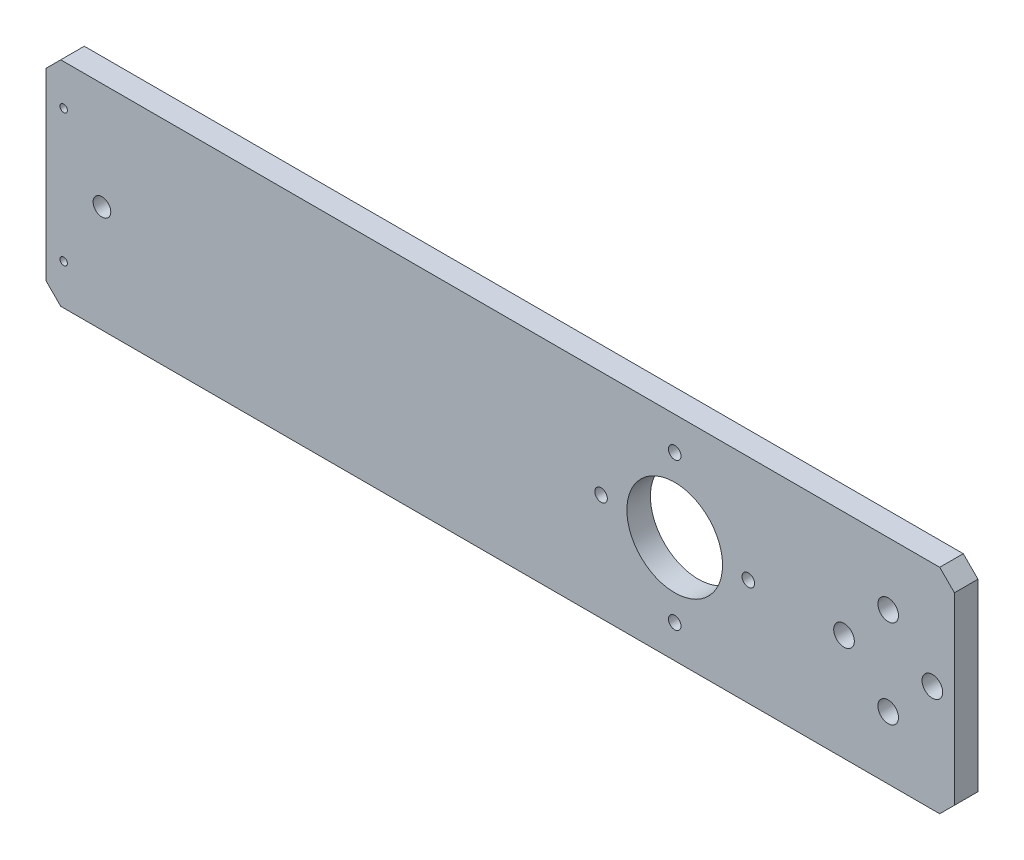
from build123d import *

# Parameters (mm, degrees)
SKETCH_1_R              = 7
SKETCH_1_R_2            = 3
SKETCH_1_R_3            = 32.5
EXTRUDE_1_DEPTH         = 16
HOLE_WIZARD_M14_1_D     = 12
HOLE_WIZARD_M14_1_DEPTH = 34
HOLE_WIZARD_M14_1_TIP   = 3.605163714
HOLE_WIZARD_M6_1_D      = 5
HOLE_WIZARD_M6_1_DEPTH  = 18
HOLE_WIZARD_M6_1_TIP    = 1.502151548
HOLE_WIZARD_M10_2_D     = 8.5
HOLE_WIZARD_M10_2_DEPTH = 24.5
HOLE_WIZARD_M10_2_TIP   = 2.553657631


with BuildPart() as part:
    # 草图1 → 凸台-拉伸1 (new body)
    with BuildSketch(Plane.XY):
        Polygon((637.687566056, 879.677968159), (637.687566056, 754.677968159), (647.687566056, 744.677968159), (1244.687566056, 744.677968159), (1254.687566056, 754.677968159), (1254.687566056, 879.677968159), (1244.687566056, 889.677968159), (647.687566056, 889.677968159), align=None)
        with Locations((1209.687566056, 787.177968159)):
            Circle(SKETCH_1_R, mode=Mode.SUBTRACT)
        with Locations((1064.687566056, 767.177968159)):
            Circle(SKETCH_1_R_2, mode=Mode.SUBTRACT)
        with Locations((1064.687566056, 817.177968159)):
            Circle(SKETCH_1_R_3, mode=Mode.SUBTRACT)
        with Locations((1014.687566056, 817.177968159)):
            Circle(SKETCH_1_R_2, mode=Mode.SUBTRACT)
        with Locations((1114.687566056, 817.177968159)):
            Circle(SKETCH_1_R_2, mode=Mode.SUBTRACT)
        with Locations((1064.687566056, 867.177968159)):
            Circle(SKETCH_1_R_2, mode=Mode.SUBTRACT)
        with Locations((1239.687566056, 817.177968159)):
            Circle(SKETCH_1_R, mode=Mode.SUBTRACT)
        with Locations((1179.687566056, 817.177968159)):
            Circle(SKETCH_1_R, mode=Mode.SUBTRACT)
        with Locations((1209.687566056, 847.177968159)):
            Circle(SKETCH_1_R, mode=Mode.SUBTRACT)
    extrude(amount=EXTRUDE_1_DEPTH)

    # M14 螺纹孔1
    with Locations(Plane.XY.offset(16)):
        with Locations((675.687566056, 817.177968159)):
            Hole(HOLE_WIZARD_M14_1_D / 2, depth=HOLE_WIZARD_M14_1_DEPTH)
            with Locations((0, 0, -(HOLE_WIZARD_M14_1_DEPTH + HOLE_WIZARD_M14_1_TIP / 2))):  # 118° drill point
                Cone(0, HOLE_WIZARD_M14_1_D / 2, HOLE_WIZARD_M14_1_TIP, mode=Mode.SUBTRACT)

    # M6 螺纹孔1
    with Locations(Plane(origin=(0, 0, 0), x_dir=(-1, 0, 0), z_dir=(0, 0, -1))):
        with Locations((-649.687566056, 772.177968159), (-649.687566056, 862.177968159)):
            Hole(HOLE_WIZARD_M6_1_D / 2, depth=HOLE_WIZARD_M6_1_DEPTH)
            with Locations((0, 0, -(HOLE_WIZARD_M6_1_DEPTH + HOLE_WIZARD_M6_1_TIP / 2))):  # 118° drill point
                Cone(0, HOLE_WIZARD_M6_1_D / 2, HOLE_WIZARD_M6_1_TIP, mode=Mode.SUBTRACT)

    # M10 螺纹孔2
    with Locations(Plane.XY.offset(16)):
        with Locations((1014.687566056, 817.177968159), (1064.687566056, 767.177968159), (1114.687566056, 817.177968159), (1064.687566056, 867.177968159)):
            Hole(HOLE_WIZARD_M10_2_D / 2, depth=HOLE_WIZARD_M10_2_DEPTH)
            with Locations((0, 0, -(HOLE_WIZARD_M10_2_DEPTH + HOLE_WIZARD_M10_2_TIP / 2))):  # 118° drill point
                Cone(0, HOLE_WIZARD_M10_2_D / 2, HOLE_WIZARD_M10_2_TIP, mode=Mode.SUBTRACT)


solid = part.part
